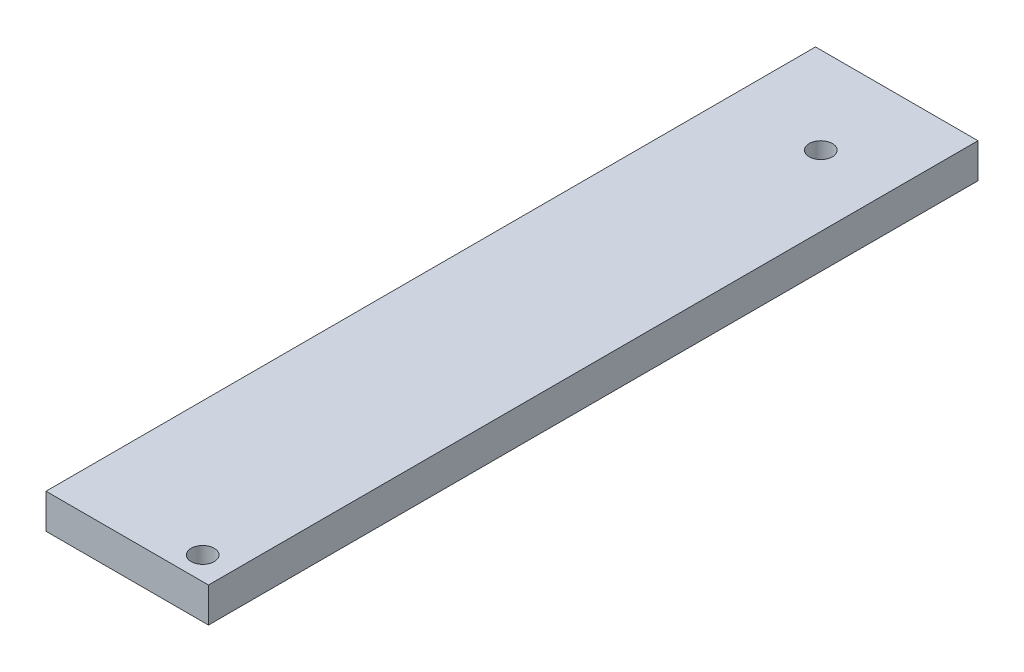
from build123d import *

# Parameters (mm, degrees)
SKETCH1_W           = 28.08
SKETCH1_H           = 133
BOSS_EXTRUDE1_DEPTH = 6
SKETCH2_R           = 2
CUT_EXTRUDE1_DEPTH  = 74.498462865
SKETCH3_R           = 2
CUT_EXTRUDE2_DEPTH  = 74.498462865


with BuildPart() as part:
    # Sketch1 → Boss-Extrude1 (new body)
    with BuildSketch(Plane(origin=(0, 0, 0), x_dir=(1, 0, 0), z_dir=(0, 1, 0))):
        with Locations((-2.356216216, -4.894594595)):
            Rectangle(SKETCH1_W, SKETCH1_H)
    extrude(amount=BOSS_EXTRUDE1_DEPTH)

    # Sketch2 → Cut-Extrude1 (cut, through all)
    with BuildSketch(Plane(origin=(0, 6, 0), x_dir=(1, 0, 0), z_dir=(0, 1, 0))):
        with Locations(Location((-0.486216216, 46.605405405, 0), (0, 0, 270))):
            Circle(SKETCH2_R)
    extrude(amount=-CUT_EXTRUDE1_DEPTH, mode=Mode.SUBTRACT)

    # Sketch3 → Cut-Extrude2 (cut, through all)
    with BuildSketch(Plane.XZ):
        with Locations(Location((6.683783784, 67.394594595, 0), (0, 0, 270))):
            Circle(SKETCH3_R)
    extrude(amount=-CUT_EXTRUDE2_DEPTH, mode=Mode.SUBTRACT)


solid = part.part
